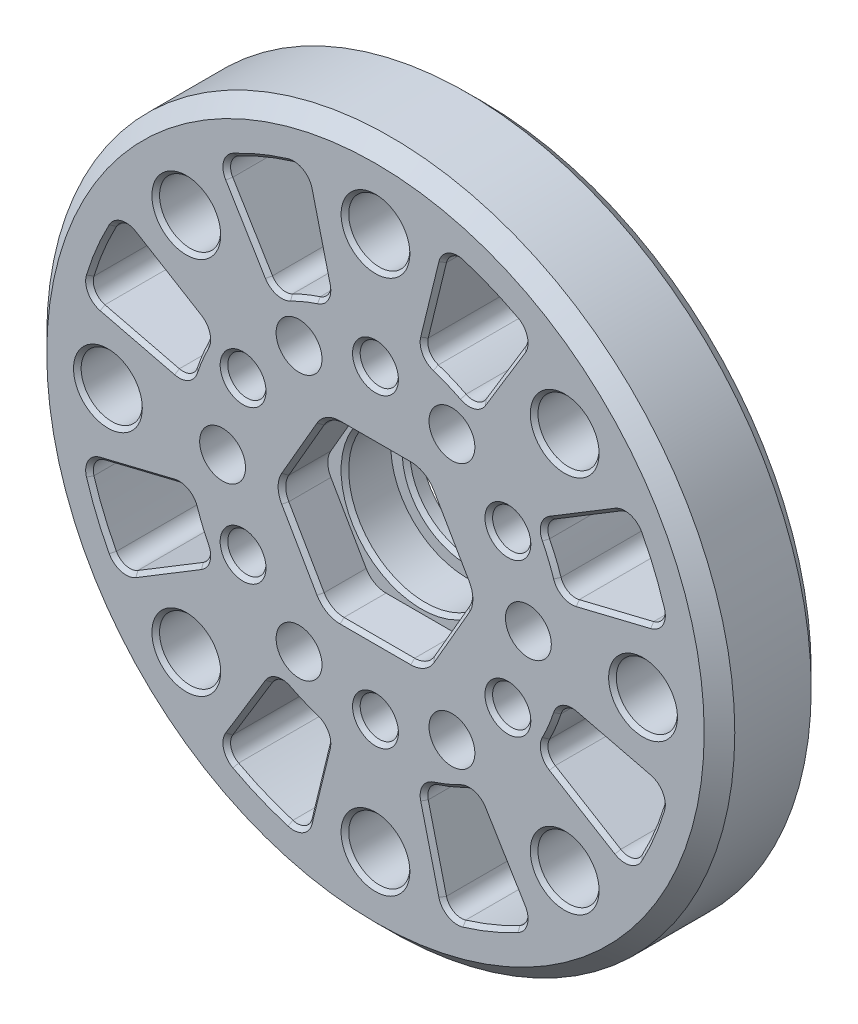
from build123d import *

# Parameters (mm, degrees)
SKETCH_1_R                       = 22.5
SKETCH_1_R_2                     = 2
EXTRUDE_1_DEPTH                  = 7
SKETCH_7_R                       = 5
SKETCH_7_R_2                     = 0.5
CUT_EXTRUDE_3_DEPTH              = 33.580669115
M3X0_5_1_D                       = 2.5
M3X0_5_1_CSINK_D                 = 3
M3X0_5_1_CSINK_ANGLE             = 90
CHAMFER_1_SIZE                   = 1
CUT_EXTRUDE_4_DEPTH              = 33.580669115
FILLET_1_R                       = 1
PATTERN_CIRCULAR_1_COUNT         = 8
FILLET_1_OF_PATTERN_CIRCULAR_1_R = 1
EXTRUDE_START                    = 1
SKETCH_12_R                      = 5
SKETCH_12_R_2                    = 4
EXTRUDE_3_DEPTH                  = 1
CHAMFER_3_SIZE                   = 0.25
CUT_EXTRUDE_6_DEPTH              = 3
FILLET_4_R                       = 1.5
CHAMFER_5_SIZE                   = 0.25
CHAMFER_8_SIZE                   = 0.25
SKETCH_18_R                      = 1.5
CUT_EXTRUDE_7_DEPTH              = 33.580669115


with BuildPart() as part:
    # ｽｹｯﾁ1 → ﾎﾞｽ - 押し出し1 (new body)
    with BuildSketch(Plane.XY):
        Circle(SKETCH_1_R)
        with Locations((0, 17.5)):
            Circle(SKETCH_1_R_2, mode=Mode.SUBTRACT)
        with Locations((12.374368671, 12.374368671)):
            Circle(SKETCH_1_R_2, mode=Mode.SUBTRACT)
        with Locations((17.5, 0)):
            Circle(SKETCH_1_R_2, mode=Mode.SUBTRACT)
        with Locations((12.374368671, -12.374368671)):
            Circle(SKETCH_1_R_2, mode=Mode.SUBTRACT)
        with Locations((0, -17.5)):
            Circle(SKETCH_1_R_2, mode=Mode.SUBTRACT)
        with Locations((-12.374368671, -12.374368671)):
            Circle(SKETCH_1_R_2, mode=Mode.SUBTRACT)
        with Locations((-17.5, 0)):
            Circle(SKETCH_1_R_2, mode=Mode.SUBTRACT)
        with Locations((-12.374368671, 12.374368671)):
            Circle(SKETCH_1_R_2, mode=Mode.SUBTRACT)
    extrude(amount=EXTRUDE_1_DEPTH)

    # ｽｹｯﾁ7 → ｶｯﾄ - 押し出し3 (cut, through all)
    with BuildSketch(Plane.XY.offset(7)):
        Circle(SKETCH_7_R)
        with Locations((0, 10)):
            Circle(SKETCH_7_R_2)
        with Locations((8.660254038, 5)):
            Circle(SKETCH_7_R_2)
        with Locations((8.660254038, -5)):
            Circle(SKETCH_7_R_2)
        with Locations((0, -10)):
            Circle(SKETCH_7_R_2)
        with Locations((-8.660254038, -5)):
            Circle(SKETCH_7_R_2)
        with Locations((-8.660254038, 5)):
            Circle(SKETCH_7_R_2)
    extrude(amount=-CUT_EXTRUDE_3_DEPTH, mode=Mode.SUBTRACT)

    # M3x0.5 ねじ穴1 (through all)
    with Locations(Plane.XY.offset(7)):
        with Locations((0, 10), (8.660254038, 5), (8.660254038, -5), (0, -10), (-8.660254038, -5), (-8.660254038, 5)):
            CounterSinkHole(M3X0_5_1_D / 2, M3X0_5_1_CSINK_D / 2, counter_sink_angle=M3X0_5_1_CSINK_ANGLE)

    # 面取り1
    chamfer_1_edges = [part.edges().sort_by_distance(p)[0] for p in [
        (-22.5, 0, 0),
        (-22.5, 0, 7),
    ]]
    chamfer(chamfer_1_edges, length=CHAMFER_1_SIZE)

    # ｽｹｯﾁ10 → ｶｯﾄ - 押し出し4 (cut, through all)
    with BuildSketch(Plane.XY.offset(7)):
        with BuildLine():
            Line((6.484665727, 10.686398383), (10.116078534, 16.670781478))
            ThreePointArc((10.116078534, 16.670781478), (7.462326931, 18.015650884), (4.6348749, 18.941170361))
            Line((4.6348749, 18.941170361), (2.971073654, 12.141775873))
            ThreePointArc((2.971073654, 12.141775873), (4.783542905, 11.548494156), (6.484665727, 10.686398383))
        make_face()
    cut_extrude_4 = extrude(amount=-CUT_EXTRUDE_4_DEPTH, mode=Mode.SUBTRACT)

    # ﾌｨﾚｯﾄ1
    fillet_1_edges = [part.edges().sort_by_distance(p)[0] for p in [
        (4.6348749, 18.941170361, 3.5),
        (10.116078534, 16.670781478, 3.5),
        (6.484665727, 10.686398383, 3.5),
        (2.971073654, 12.141775873, 3.5),
    ]]
    fillet(fillet_1_edges, radius=FILLET_1_R)

    # 円形ﾊﾟﾀｰﾝ1: ｶｯﾄ - 押し出し4 ×8 about axis
    pattern_circular_1_axis = Axis((0, 0, 0), (0, 0, 1))
    for i in range(1, PATTERN_CIRCULAR_1_COUNT):
        add(cut_extrude_4.rotate(pattern_circular_1_axis, i * 360 / PATTERN_CIRCULAR_1_COUNT), mode=Mode.SUBTRACT)

    # ﾌｨﾚｯﾄ1 of 円形ﾊﾟﾀｰﾝ1
    fillet_1_of_pattern_circular_1_edges = [part.edges().sort_by_distance(p)[0] for p in [
        (-10.116078534, 16.670781478, 3.5),
        (-4.6348749, 18.941170361, 3.5),
        (-2.971073654, 12.141775873, 3.5),
        (-6.484665727, 10.686398383, 3.5),
        (-18.941170361, 4.6348749, 3.5),
        (-16.670781478, 10.116078534, 3.5),
        (-10.686398383, 6.484665727, 3.5),
        (-12.141775873, 2.971073654, 3.5),
        (-16.670781478, -10.116078534, 3.5),
        (-18.941170361, -4.6348749, 3.5),
        (-12.141775873, -2.971073654, 3.5),
        (-10.686398383, -6.484665727, 3.5),
        (-4.6348749, -18.941170361, 3.5),
        (-10.116078534, -16.670781478, 3.5),
        (-6.484665727, -10.686398383, 3.5),
        (-2.971073654, -12.141775873, 3.5),
        (10.116078534, -16.670781478, 3.5),
        (4.6348749, -18.941170361, 3.5),
        (2.971073654, -12.141775873, 3.5),
        (6.484665727, -10.686398383, 3.5),
        (18.941170361, -4.6348749, 3.5),
        (16.670781478, -10.116078534, 3.5),
        (10.686398383, -6.484665727, 3.5),
        (12.141775873, -2.971073654, 3.5),
        (16.670781478, 10.116078534, 3.5),
        (18.941170361, 4.6348749, 3.5),
        (12.141775873, 2.971073654, 3.5),
        (10.686398383, 6.484665727, 3.5),
    ]]
    fillet(fillet_1_of_pattern_circular_1_edges, radius=FILLET_1_OF_PATTERN_CIRCULAR_1_R)

    # ｽｹｯﾁ12 → ﾎﾞｽ - 押し出し3 (add)
    with BuildSketch(Plane.XY.offset(EXTRUDE_START)):
        Circle(SKETCH_12_R)
        Circle(SKETCH_12_R_2, mode=Mode.SUBTRACT)
    extrude(amount=-EXTRUDE_3_DEPTH)

    # 面取り3
    chamfer_3_edges = [part.edges().sort_by_distance(p)[0] for p in [
        (15.5, 0, 7),
        (10.374368671, -12.374368671, 7),
        (-2, -17.5, 7),
        (-14.374368671, -12.374368671, 7),
        (-19.5, 0, 7),
        (-14.374368671, 12.374368671, 7),
        (-4, 0, 1),
        (-2, 17.5, 7),
        (10.374368671, 12.374368671, 7),
    ]]
    chamfer(chamfer_3_edges, length=CHAMFER_3_SIZE)

    # ｽｹｯﾁ14 → ｶｯﾄ - 押し出し6 (cut)
    with BuildSketch(Plane.XY.offset(7)):
        Polygon((3.175426481, 5.5), (-3.175426481, 5.5), (-6.350852961, 0), (-3.175426481, -5.5), (3.175426481, -5.5), (6.350852961, 0), align=None)
    extrude(amount=-CUT_EXTRUDE_6_DEPTH, mode=Mode.SUBTRACT)

    # ﾌｨﾚｯﾄ4
    fillet_4_edges = [part.edges().sort_by_distance(p)[0] for p in [
        (3.175426481, 5.5, 5.5),
        (6.350852961, 0, 5.5),
        (3.175426481, -5.5, 5.5),
        (-3.175426481, -5.5, 5.5),
        (-6.350852961, 0, 5.5),
        (-3.175426481, 5.5, 5.5),
    ]]
    fillet(fillet_4_edges, radius=FILLET_4_R)

    # 面取り5
    chamfer_5_edges = [part.edges().sort_by_distance(p)[0] for p in [
        (-5, 0, 4),
        (4.763139721, -2.75, 7),
        (0, -5.5, 7),
        (4.763139721, 2.75, 7),
        (0, 5.5, 7),
        (-4.763139721, -2.75, 7),
        (-4.763139721, 2.75, 7),
        (3.059401077, -5.299038106, 7),
        (6.118802154, 0, 7),
        (3.059401077, 5.299038106, 7),
        (-6.118802154, 0, 7),
        (-3.059401077, -5.299038106, 7),
        (-3.059401077, 5.299038106, 7),
    ]]
    chamfer(chamfer_5_edges, length=CHAMFER_5_SIZE)

    # 面取り8
    chamfer_8_edges = [part.edges().sort_by_distance(p)[0] for p in [
        (8.283736426, 13.651175138, 7),
        (4.783542905, 11.548494156, 7),
        (3.795352311, 15.510324712, 7),
        (7.462326931, 18.015650884, 7),
        (6.402809818, 11.066511081, 7),
        (3.297734789, 12.35267527, 7),
        (9.69292294, 16.575381329, 7),
        (4.866632998, 18.574496078, 7),
        (-3.795352311, 15.510324712, 7),
        (-4.783542905, 11.548494156, 7),
        (-8.283736426, 13.651175138, 7),
        (-7.462326931, 18.015650884, 7),
        (-3.297734789, 12.35267527, 7),
        (-6.402809818, 11.066511081, 7),
        (-4.866632998, 18.574496078, 7),
        (-9.69292294, 16.575381329, 7),
        (-13.651175138, 8.283736426, 7),
        (-11.548494156, 4.783542905, 7),
        (-15.510324712, 3.795352311, 7),
        (-18.015650884, 7.462326931, 7),
        (-11.066511081, 6.402809818, 7),
        (-12.35267527, 3.297734789, 7),
        (-16.575381329, 9.69292294, 7),
        (-18.574496078, 4.866632998, 7),
        (-15.510324712, -3.795352311, 7),
        (-11.548494156, -4.783542905, 7),
        (-13.651175138, -8.283736426, 7),
        (-18.015650884, -7.462326931, 7),
        (-12.35267527, -3.297734789, 7),
        (-11.066511081, -6.402809818, 7),
        (-18.574496078, -4.866632998, 7),
        (-16.575381329, -9.69292294, 7),
        (-8.283736426, -13.651175138, 7),
        (-4.783542905, -11.548494156, 7),
        (-3.795352311, -15.510324712, 7),
        (-7.462326931, -18.015650884, 7),
        (-6.402809818, -11.066511081, 7),
        (-3.297734789, -12.35267527, 7),
        (-9.69292294, -16.575381329, 7),
        (-4.866632998, -18.574496078, 7),
        (3.795352311, -15.510324712, 7),
        (4.783542905, -11.548494156, 7),
        (8.283736426, -13.651175138, 7),
        (7.462326931, -18.015650884, 7),
        (3.297734789, -12.35267527, 7),
        (6.402809818, -11.066511081, 7),
        (4.866632998, -18.574496078, 7),
        (9.69292294, -16.575381329, 7),
        (13.651175138, -8.283736426, 7),
        (11.548494156, -4.783542905, 7),
        (15.510324712, -3.795352311, 7),
        (18.015650884, -7.462326931, 7),
        (11.066511081, -6.402809818, 7),
        (12.35267527, -3.297734789, 7),
        (16.575381329, -9.69292294, 7),
        (18.574496078, -4.866632998, 7),
        (15.510324712, 3.795352311, 7),
        (11.548494156, 4.783542905, 7),
        (13.651175138, 8.283736426, 7),
        (18.015650884, 7.462326931, 7),
        (12.35267527, 3.297734789, 7),
        (11.066511081, 6.402809818, 7),
        (18.574496078, 4.866632998, 7),
        (16.575381329, 9.69292294, 7),
    ]]
    chamfer(chamfer_8_edges, length=CHAMFER_8_SIZE)

    # ｽｹｯﾁ18 → ｶｯﾄ - 押し出し7 (cut, through all)
    with BuildSketch(Plane.XY.offset(7)):
        with Locations((5, 8.660254038)):
            Circle(SKETCH_18_R)
        with Locations((10, 0)):
            Circle(SKETCH_18_R)
        with Locations((5, -8.660254038)):
            Circle(SKETCH_18_R)
        with Locations((-5, -8.660254038)):
            Circle(SKETCH_18_R)
        with Locations((-10, 0)):
            Circle(SKETCH_18_R)
        with Locations((-5, 8.660254038)):
            Circle(SKETCH_18_R)
    extrude(amount=-CUT_EXTRUDE_7_DEPTH, mode=Mode.SUBTRACT)


solid = part.part
